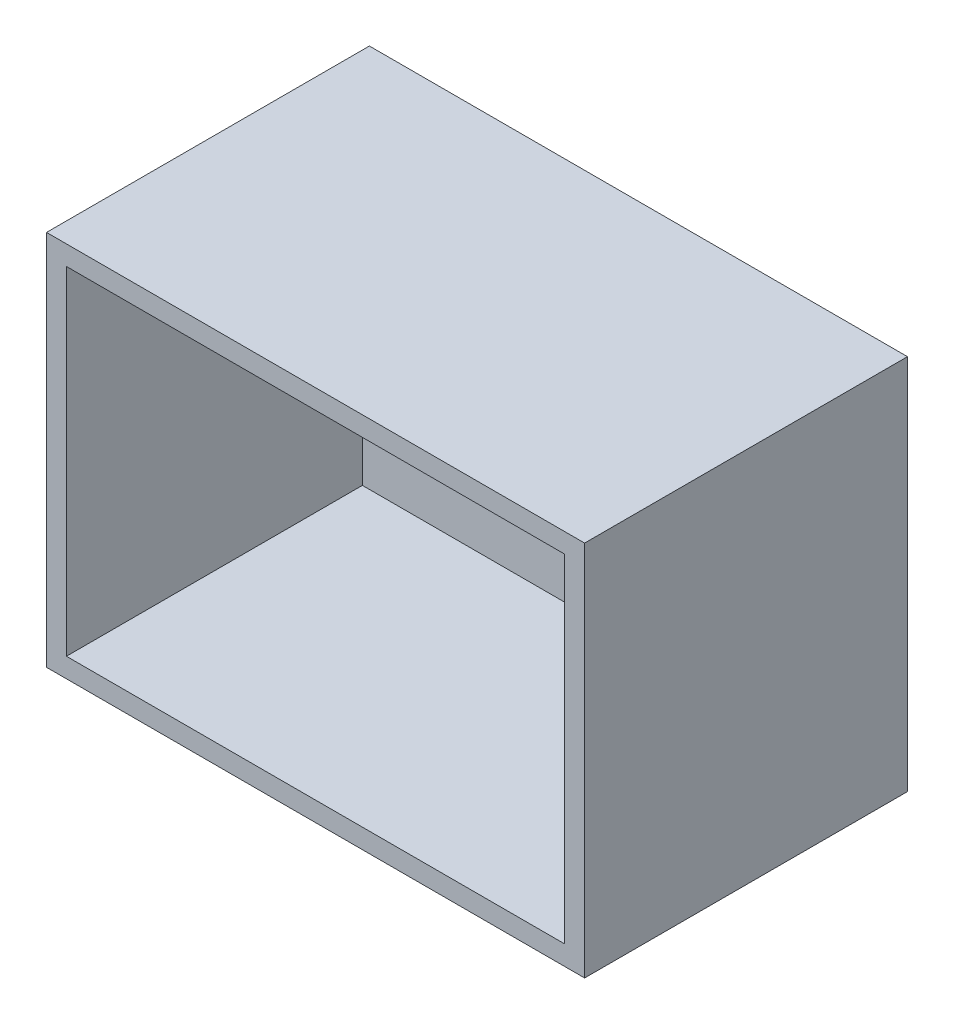
from build123d import *

# Parameters (mm, degrees)
SKETCH1_W           = 100
SKETCH1_H           = 70
BOSS_EXTRUDE1_DEPTH = 60
SKETCH2_W           = 92.598842388
SKETCH2_H           = 62.734436728
CUT_EXTRUDE1_DEPTH  = 55


with BuildPart() as part:
    # Sketch1 → Boss-Extrude1 (new body)
    with BuildSketch(Plane.XY):
        with Locations((50, 35)):
            Rectangle(SKETCH1_W, SKETCH1_H)
    extrude(amount=BOSS_EXTRUDE1_DEPTH)

    # Sketch2 → Cut-Extrude1 (cut)
    with BuildSketch(Plane.XY.offset(60)):
        with Locations((50, 35)):
            Rectangle(SKETCH2_W, SKETCH2_H)
    extrude(amount=-CUT_EXTRUDE1_DEPTH, mode=Mode.SUBTRACT)


solid = part.part
